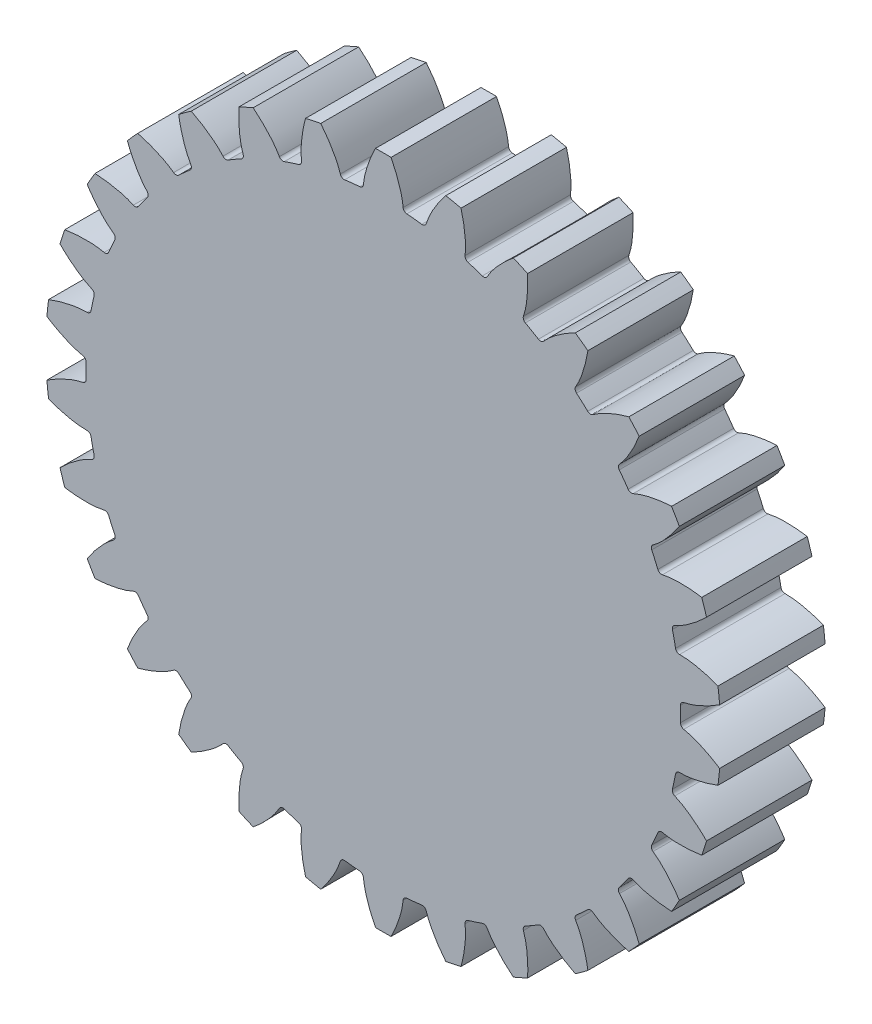
from build123d import *

# Parameters (mm, degrees)
CIRCLES_R                       = 32
GEAR_EXTRUDE_DEPTH              = 10
EXTRUDED_CUT1_DEPTH             = 47.346520905
FILLET1_R                       = 0.38
CIRCULAR_PARTTERN1_COUNT        = 30
FILLET1_OF_CIRCULAR_PARTTERN1_R = 0.38


with BuildPart() as part:
    # circles → Gear_extrude (new body)
    with BuildSketch(Plane.XY):
        Circle(CIRCLES_R)
    extrude(amount=GEAR_EXTRUDE_DEPTH)

    # Db_Df → extruded-cut1 (cut, through all)
    with BuildSketch(Plane.XY.offset(10)):
        with BuildLine():
            Line((43.195260585, 29.829221635), (60.24780414, -1.577593327))
            Line((60.24780414, -1.577593327), (43.195260585, -29.829221635))
            add(Edge.make_bspline(
                [(28.171006316, -1.055652659), (28.222330565, -1.059287511), (28.36576505, -1.074751718), (28.63444311, -1.124727659), (29.066544171, -1.235348153), (29.605856963, -1.418340301), (30.286220251, -1.702131211), (31.062919909, -2.095569073), (31.886221202, -2.588218453), (32.96015221, -3.33592167), (34.172835825, -4.336988753), (35.451034565, -5.599810453), (36.776880432, -7.173914188), (37.968062752, -8.851748884), (39.028539988, -10.61489508), (39.97640045, -12.483857451), (40.795821505, -14.412381573), (41.403764256, -16.141971527), (41.849276483, -17.648429077), (42.171275731, -18.917053167), (42.399761691, -19.938927686), (42.649530672, -21.223675861), (42.852230114, -22.517031266), (43.008946515, -23.816501894), (43.120707656, -25.120748309), (43.183586344, -26.165545804), (43.215694433, -27.081865638), (43.227206025, -27.865688083), (43.226041731, -28.52321693), (43.219399456, -29.033262178), (43.20775375, -29.468288559), (43.199715671, -29.710333787), (43.195260585, -29.829221635)],
                knots=[0, 0, 0, 0, 0, 0.005376747, 0.015083687, 0.028531819, 0.046610138, 0.064854847, 0.092110523, 0.119476173, 0.146842493, 0.201574954, 0.256307345, 0.307035031, 0.361767349, 0.416499658, 0.471231934, 0.525964279, 0.580696613, 0.608062797, 0.635428981, 0.662795184, 0.690161387, 0.744893689, 0.772259886, 0.799626084, 0.826992247, 0.854358411, 0.868041538, 0.881724665, 0.895407792, 0.909090919, 0.909090919, 0.909090919, 0.909090919, 0.909090919], degree=4))
            ThreePointArc((28.171006316, -1.055652659), (28.190778624, 0), (28.171006316, 1.055652659))
            add(Edge.make_bspline(
                [(28.171006316, 1.055652659), (28.222330565, 1.059287511), (28.36576505, 1.074751718), (28.63444311, 1.124727659), (29.066544171, 1.235348153), (29.605856963, 1.418340301), (30.286220251, 1.702131211), (31.062919909, 2.095569073), (31.886221202, 2.588218453), (32.96015221, 3.33592167), (34.172835825, 4.336988753), (35.451034565, 5.599810453), (36.776880432, 7.173914188), (37.968062752, 8.851748884), (39.028539988, 10.61489508), (39.97640045, 12.483857451), (40.795821505, 14.412381573), (41.403764256, 16.141971527), (41.849276483, 17.648429077), (42.171275731, 18.917053167), (42.399761691, 19.938927686), (42.649530672, 21.223675861), (42.852230114, 22.517031266), (43.008946515, 23.816501894), (43.120707656, 25.120748309), (43.183586344, 26.165545804), (43.215694433, 27.081865638), (43.227206025, 27.865688083), (43.226041731, 28.52321693), (43.219399456, 29.033262178), (43.20775375, 29.468288559), (43.199715671, 29.710333787), (43.195260585, 29.829221635)],
                knots=[0, 0, 0, 0, 0, 0.005376747, 0.015083687, 0.028531819, 0.046610138, 0.064854847, 0.092110523, 0.119476173, 0.146842493, 0.201574954, 0.256307345, 0.307035031, 0.361767349, 0.416499658, 0.471231934, 0.525964279, 0.580696613, 0.608062797, 0.635428981, 0.662795184, 0.690161387, 0.744893689, 0.772259886, 0.799626084, 0.826992247, 0.854358411, 0.868041538, 0.881724665, 0.895407792, 0.909090919, 0.909090919, 0.909090919, 0.909090919, 0.909090919], degree=4))
        make_face()
    extruded_cut1 = extrude(amount=-EXTRUDED_CUT1_DEPTH, mode=Mode.SUBTRACT)

    # fillet1
    fillet1_edges = [part.edges().sort_by_distance(p)[0] for p in [
        (28.171006316, -1.055652659, 5),
        (28.171006316, 1.055652659, 5),
    ]]
    fillet(fillet1_edges, radius=FILLET1_R)

    # circular-parttern1: extruded-cut1 ×30 about axis
    circular_parttern1_axis = Axis((0, 0, 10), (0, 0, -1))
    for i in range(1, CIRCULAR_PARTTERN1_COUNT):
        add(extruded_cut1.rotate(circular_parttern1_axis, i * 360 / CIRCULAR_PARTTERN1_COUNT), mode=Mode.SUBTRACT)

    # fillet1 of circular-parttern1
    fillet1_of_circular_parttern1_edges = [part.edges().sort_by_distance(p)[0] for p in [
        (27.335919709, -6.889665671, 5),
        (27.774884768, -4.82449744, 5),
        (25.306122239, -12.422567232, 5),
        (26.164867476, -10.49379385, 5),
        (22.170325794, -17.412542996, 5),
        (23.411319923, -15.704461114, 5),
        (18.065579727, -21.641507076, 5),
        (19.634585349, -20.228768069, 5),
        (13.171281138, -24.924633449, 5),
        (14.999725178, -23.868980791, 5),
        (7.70133436, -27.118433739, 5),
        (9.709305041, -26.466004516, 5),
        (1.894802316, -28.127028346, 5),
        (3.994541682, -27.906336846, 5),
        (-3.994541682, -27.906336846, 5),
        (-1.894802316, -28.127028346, 5),
        (-9.709305041, -26.466004516, 5),
        (-7.70133436, -27.118433739, 5),
        (-14.999725178, -23.868980791, 5),
        (-13.171281138, -24.924633449, 5),
        (-19.634585349, -20.228768069, 5),
        (-18.065579727, -21.641507076, 5),
        (-23.411319923, -15.704461114, 5),
        (-22.170325794, -17.412542996, 5),
        (-26.164867476, -10.49379385, 5),
        (-25.306122239, -12.422567232, 5),
        (-27.774884768, -4.82449744, 5),
        (-27.335919709, -6.889665671, 5),
        (-28.171006316, 1.055652659, 5),
        (-28.171006316, -1.055652659, 5),
        (-27.335919709, 6.889665671, 5),
        (-27.774884768, 4.82449744, 5),
        (-25.306122239, 12.422567232, 5),
        (-26.164867476, 10.49379385, 5),
        (-22.170325794, 17.412542996, 5),
        (-23.411319923, 15.704461114, 5),
        (-18.065579727, 21.641507076, 5),
        (-19.634585349, 20.228768069, 5),
        (-13.171281138, 24.924633449, 5),
        (-14.999725178, 23.868980791, 5),
        (-7.70133436, 27.118433739, 5),
        (-9.709305041, 26.466004516, 5),
        (-1.894802316, 28.127028346, 5),
        (-3.994541682, 27.906336846, 5),
        (3.994541682, 27.906336846, 5),
        (1.894802316, 28.127028346, 5),
        (9.709305041, 26.466004516, 5),
        (7.70133436, 27.118433739, 5),
        (14.999725178, 23.868980791, 5),
        (13.171281138, 24.924633449, 5),
        (19.634585349, 20.228768069, 5),
        (18.065579727, 21.641507076, 5),
        (23.411319923, 15.704461114, 5),
        (22.170325794, 17.412542996, 5),
        (26.164867476, 10.49379385, 5),
        (25.306122239, 12.422567232, 5),
        (27.774884768, 4.82449744, 5),
        (27.335919709, 6.889665671, 5),
    ]]
    fillet(fillet1_of_circular_parttern1_edges, radius=FILLET1_OF_CIRCULAR_PARTTERN1_R)


solid = part.part
